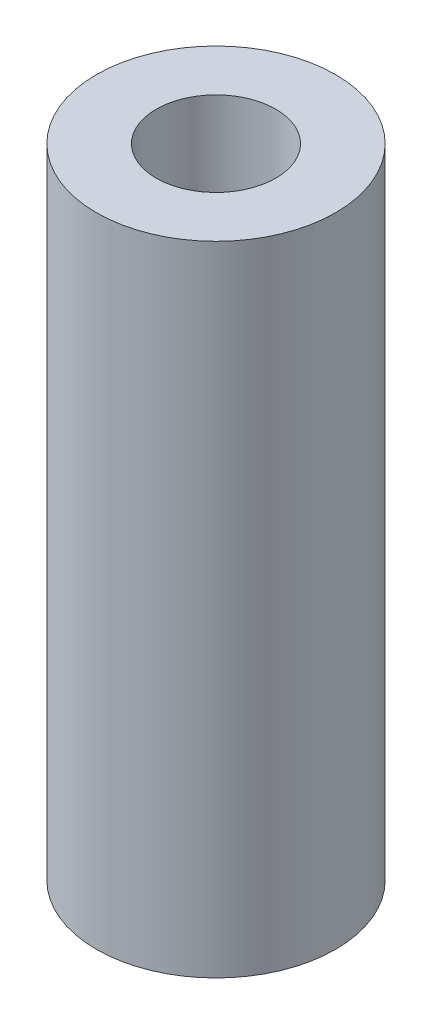
from build123d import *

# Parameters (mm, degrees)
SKETCH_1_R      = 3
SKETCH_1_R_2    = 1.5
EXTRUDE_1_DEPTH = 16


with BuildPart() as part:
    # 草图1 → 凸台-拉伸1 (new body)
    with BuildSketch(Plane(origin=(0, 0, 0), x_dir=(1, 0, 0), z_dir=(0, 1, 0))):
        with Locations(Location((0, 0, 0), (0, 0, 270))):
            Circle(SKETCH_1_R)
        with Locations(Location((0, 0, 0), (0, 0, 270))):
            Circle(SKETCH_1_R_2, mode=Mode.SUBTRACT)
    extrude(amount=EXTRUDE_1_DEPTH)


solid = part.part
